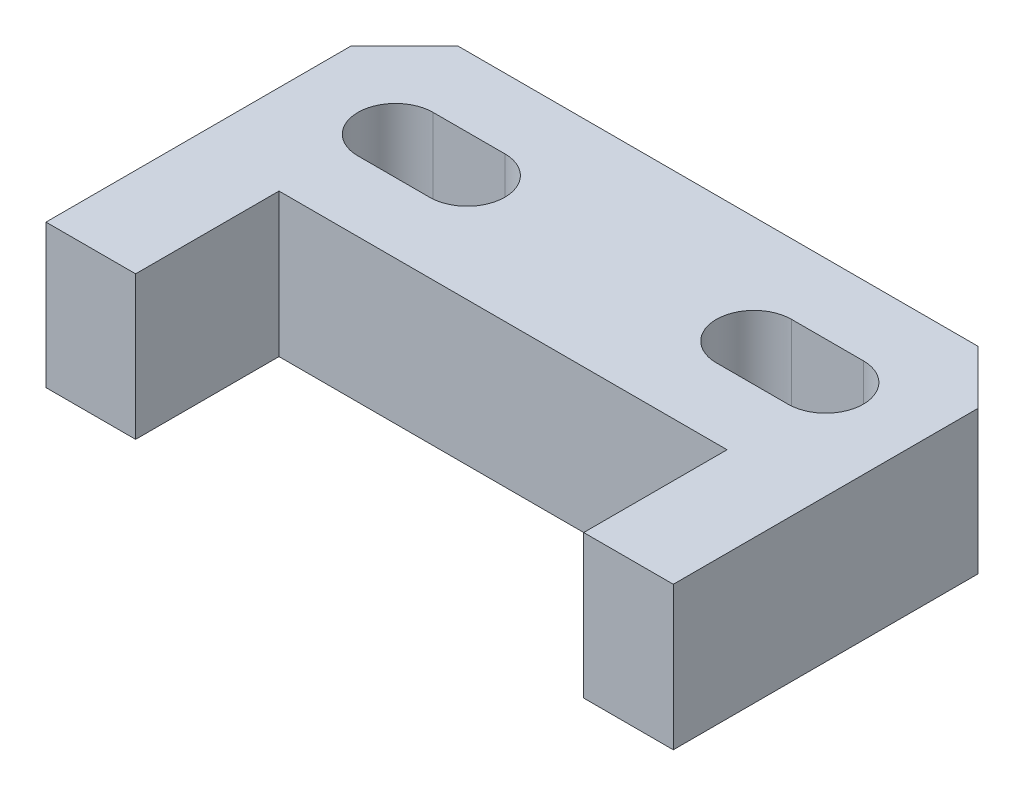
from build123d import *

# Parameters (mm, degrees)
EXTRUDE_1_DEPTH     = 8
CUT_EXTRUDE_1_DEPTH = 8
CHAMFER_1_SIZE      = 3


with BuildPart() as part:
    # 스케치1 → 보스-돌출1 (new body)
    with BuildSketch(Plane(origin=(0, 0, 0), x_dir=(1, 0, 0), z_dir=(0, 1, 0))):
        Polygon((0, 0), (0, 20), (35, 20), (35, 0), (30, 0), (30, 8), (5, 8), (5, 0), align=None)
    extrude(amount=EXTRUDE_1_DEPTH)

    # 스케치2 → 컷-돌출1 (cut)
    with BuildSketch(Plane(origin=(0, 8, 0), x_dir=(1, 0, 0), z_dir=(0, 1, 0))):
        with BuildLine():
            Line((29.5, 11.9), (25.5, 11.9))
            ThreePointArc((25.5, 11.9), (23.4, 14), (25.5, 16.1))
            Line((25.5, 16.1), (29.5, 16.1))
            ThreePointArc((29.5, 16.1), (31.6, 14), (29.5, 11.9))
        make_face()
        with BuildLine():
            Line((5.5, 16.1), (9.5, 16.1))
            ThreePointArc((9.5, 16.1), (11.6, 14), (9.5, 11.9))
            Line((9.5, 11.9), (5.5, 11.9))
            ThreePointArc((5.5, 11.9), (3.4, 14), (5.5, 16.1))
        make_face()
    extrude(amount=-CUT_EXTRUDE_1_DEPTH, mode=Mode.SUBTRACT)

    # 모따기1
    chamfer_1_edges = [part.edges().sort_by_distance(p)[0] for p in [
        (0, 4, -20),
        (35, 4, -20),
    ]]
    chamfer(chamfer_1_edges, length=CHAMFER_1_SIZE)


solid = part.part
